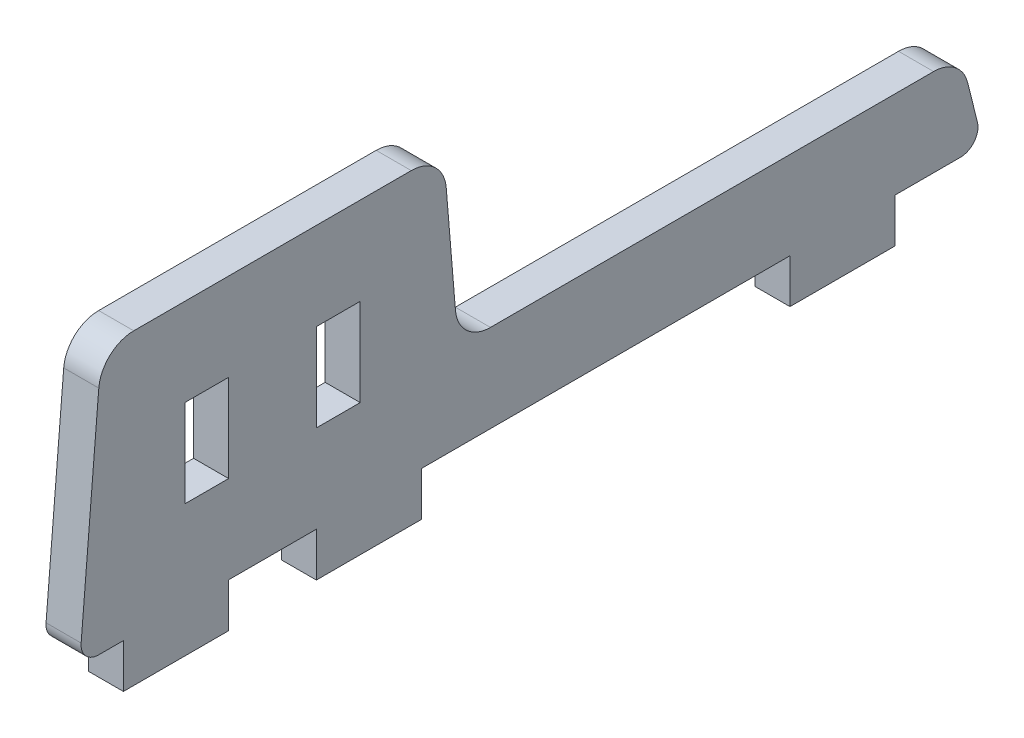
from build123d import *

# Parameters (mm, degrees)
SKETCH1_W           = 5
SKETCH1_H           = 10
BOSS_EXTRUDE1_DEPTH = 4
FILLET2_R           = 4
FILLET4_R           = 2


with BuildPart() as part:
    # Sketch1 → Boss-Extrude1 (new body)
    with BuildSketch(Plane(origin=(0, 0, 0), x_dir=(0, 0, -1), z_dir=(1, 0, 0))):
        Polygon((-46.5, -15), (-46.5, -20.025618734), (-34.5, -20.025618734), (-34.5, -15), (-24.5, -15), (-24.5, -20.025618734), (-12.5, -20.025618734), (-12.5, -15), (29.5, -15), (29.5, -20.025618734), (41.5, -20.025618734), (41.5, -15), (51.5, -15), (49, -5), (-8.333333333, -5), (-10, 15), (-49, 15), (-51.5, -15), align=None)
        with Locations((-22, 0)):
            Rectangle(SKETCH1_W, SKETCH1_H, mode=Mode.SUBTRACT)
        with Locations((-37, 0)):
            Rectangle(SKETCH1_W, SKETCH1_H, mode=Mode.SUBTRACT)
    extrude(amount=BOSS_EXTRUDE1_DEPTH)

    # Fillet2
    fillet2_edges = [part.edges().sort_by_distance(p)[0] for p in [
        (2, 15, 49),
        (2, 15, 10),
        (2, -5, 8.333333333),
        (2, -5, -49),
    ]]
    fillet(fillet2_edges, radius=FILLET2_R)

    # Fillet4
    fillet4_edges = [part.edges().sort_by_distance(p)[0] for p in [
        (2, -15, 51.5),
        (2, -15, -51.5),
    ]]
    fillet(fillet4_edges, radius=FILLET4_R)


solid = part.part
